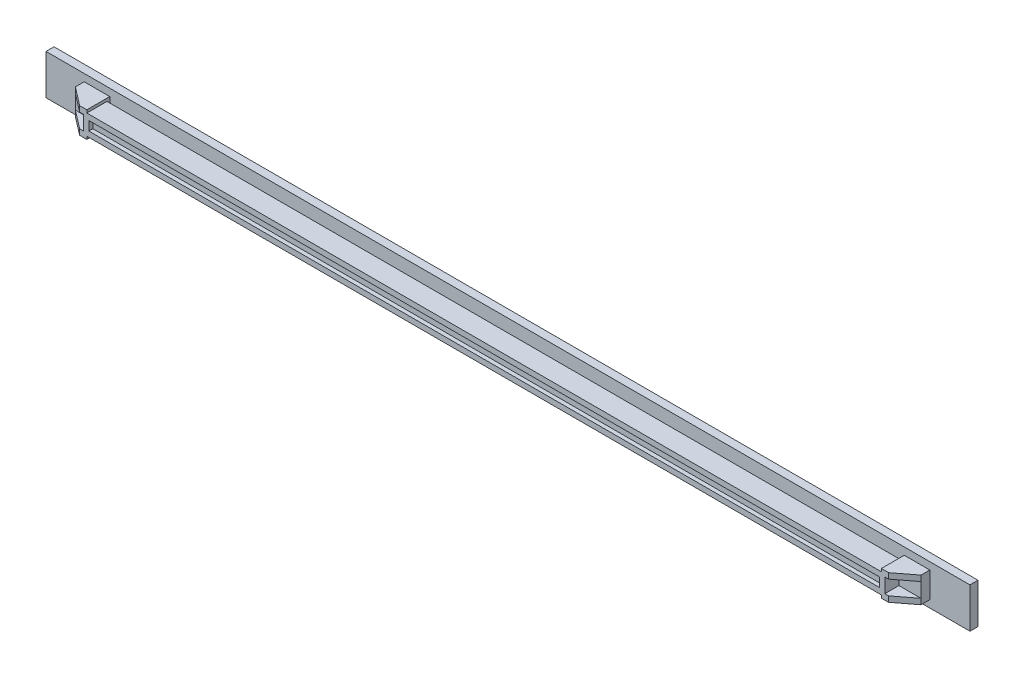
from build123d import *

# Parameters (mm, degrees)
SKETCH1_W                = 1000
SKETCH1_H                = 25
BOSS_EXTRUDE1_DEPTH      = 25
SKETCH2_W                = 986.4
SKETCH2_H                = 11.4
CUT_EXTRUDE2_DEPTH       = 5
SKETCH4_W                = 32
SKETCH4_H                = 32
SKETCH4_W_2              = 25
SKETCH4_H_2              = 25
BOSS_EXTRUDE2_DEPTH      = 6.8
SKETCH5_W                = 32
SKETCH5_H                = 32
BOSS_EXTRUDE3_DEPTH      = 25
SKETCH6_W                = 27.448100552
SKETCH6_H                = 18
CUT_EXTRUDE3_DEPTH       = 21
CUT_EXTRUDE4_DEPTH       = 43
CUT_EXTRUDE5_DEPTH       = 43
CUT_EXTRUDE5_DEPTH_BACK  = 413
BOSS_EXTRUDE5_DEPTH      = 50
BOSS_EXTRUDE5_DEPTH_BACK = 1100
SKETCH10_W               = 10
SKETCH10_H               = 50


with BuildPart() as part:
    # Sketch1 → Boss-Extrude1 (new body)
    with BuildSketch(Plane.XY):
        with Locations((500, 12.5)):
            Rectangle(SKETCH1_W, SKETCH1_H)
    extrude(amount=BOSS_EXTRUDE1_DEPTH)

    # Sketch2 → Cut-Extrude2 (cut)
    with BuildSketch(Plane.XY.offset(25)):
        with Locations((500, 12.5)):
            Rectangle(SKETCH2_W, SKETCH2_H)
    extrude(amount=-CUT_EXTRUDE2_DEPTH, mode=Mode.SUBTRACT)



with BuildPart() as body_2:
    # Sketch4 → Boss-Extrude2 (new body)
    with BuildSketch(Plane(origin=(6.8, 0, 0), x_dir=(0, 0, -1), z_dir=(1, 0, 0))):
        with Locations((-12.5, 12.5)):
            Rectangle(SKETCH4_W, SKETCH4_H)
        with Locations((-12.5, 12.5)):
            Rectangle(SKETCH4_W_2, SKETCH4_H_2, mode=Mode.SUBTRACT)
    extrude(amount=-BOSS_EXTRUDE2_DEPTH)


with BuildPart() as part_1:
    add(part.part)

    add(body_2.part)  # Boss-Extrude3 merges body 2
    # Sketch5 → Boss-Extrude3 (add)
    with BuildSketch(Plane.ZY):
        with Locations((12.5, 12.5)):
            Rectangle(SKETCH5_W, SKETCH5_H)
    extrude(amount=BOSS_EXTRUDE3_DEPTH)

    # Sketch6 → Cut-Extrude3 (cut)
    with BuildSketch(Plane.XY.offset(28.5)):
        with Locations((-11.275949724, 12.5)):
            Rectangle(SKETCH6_W, SKETCH6_H)
    extrude(amount=-CUT_EXTRUDE3_DEPTH, mode=Mode.SUBTRACT)

    # Sketch7 → Cut-Extrude4 (cut)
    with BuildSketch(Plane.XZ.offset(3.5)):
        Polygon((2.448100552, 28.5), (-25, 28.5), (-25, 7.5), align=None)
    extrude(amount=-CUT_EXTRUDE4_DEPTH, mode=Mode.SUBTRACT)

    # Sketch8 → Cut-Extrude5 (cut, two sides: drawn at the far end of the back side and taken through both)
    with BuildSketch(Plane.ZY.offset(-2.448100552).offset(-CUT_EXTRUDE5_DEPTH_BACK)):
        with BuildLine():
            Line((20, 6.8), (23, 6.8))
            ThreePointArc((23, 6.8), (24.414213562, 6.214213562), (25, 4.8))
            Line((25, 4.8), (25, -5.020840196))
            Line((25, -5.020840196), (31.991589763, -5.020840196))
            Line((31.991589763, -5.020840196), (31.991589763, 30.746420452))
            Line((31.991589763, 30.746420452), (25, 30.746420452))
            Line((25, 30.746420452), (25, 20.2))
            ThreePointArc((25, 20.2), (24.414213562, 18.785786438), (23, 18.2))
            Line((23, 18.2), (20, 18.2))
            Line((20, 18.2), (20, 6.8))
        make_face()
    extrude(amount=CUT_EXTRUDE5_DEPTH + CUT_EXTRUDE5_DEPTH_BACK, mode=Mode.SUBTRACT)

    # Mirror6: part across plane


with BuildPart() as part_2:
    add(part_1.part)
    add(part_1.part.mirror(Plane(origin=(501.224050276, 0, 0), x_dir=(0, 0, 1), z_dir=(1, 0, 0))))


with BuildPart() as body_2_2:
    # Sketch10 → Boss-Extrude5 (new, two sides: drawn at the far end of the back side and taken through both)
    with BuildSketch(Plane(origin=(1027.448100552, 0, 0), x_dir=(0, 0, -1), z_dir=(1, 0, 0)).offset(-BOSS_EXTRUDE5_DEPTH_BACK)):
        with Locations((8.5, 12.5)):
            Rectangle(SKETCH10_W, SKETCH10_H)
    extrude(amount=BOSS_EXTRUDE5_DEPTH + BOSS_EXTRUDE5_DEPTH_BACK)


solid = Compound([part_2.part, body_2_2.part])
